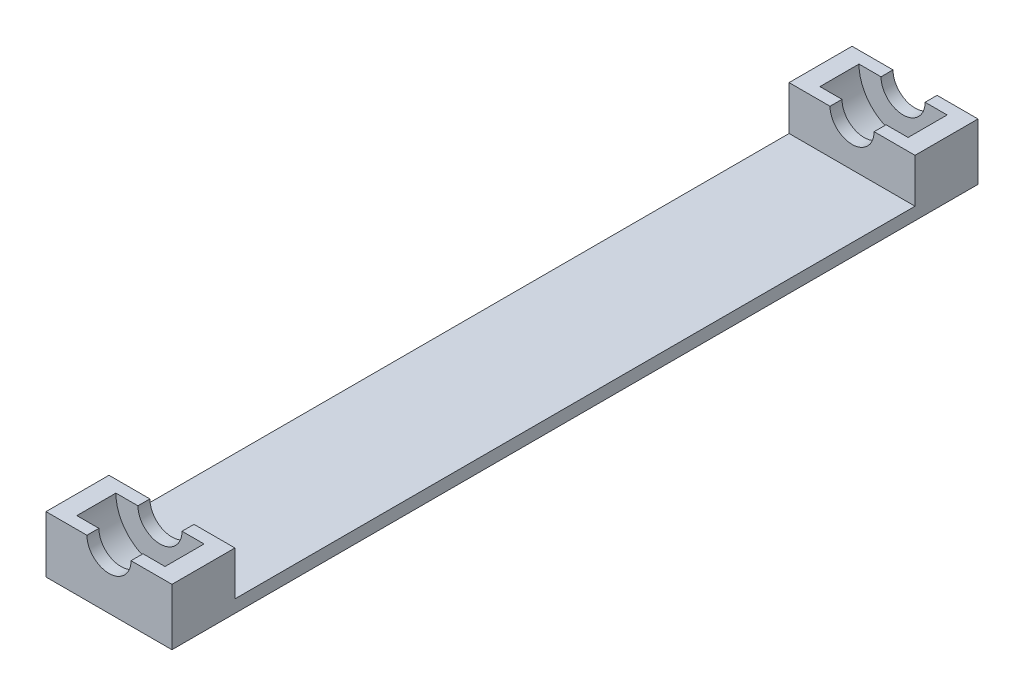
from build123d import *

# Parameters (mm, degrees)
BOSS_EXTRUDE1_DEPTH = 10
SKETCH2_R           = 3.5
SKETCH2_R_2         = 1.75
CUT_EXTRUDE1_DEPTH  = 1.55
SKETCH2_2_R         = 1.75
CUT_EXTRUDE2_DEPTH  = 6.6


with BuildPart() as part:
    # Sketch1 → Boss-Extrude1 (new body)
    with BuildSketch(Plane(origin=(0, 0, 0), x_dir=(0, 0, -1), z_dir=(1, 0, 0))):
        Polygon((-32, 4), (-32, -0.5), (32, -0.5), (32, 4), (27, 4), (27, 0.5), (-27, 0.5), (-27, 4), align=None)
    extrude(amount=BOSS_EXTRUDE1_DEPTH)

    # Sketch2 → Cut-Extrude1 (cut, symmetric)
    with BuildSketch(Plane.XY.offset(29.5)):
        with Locations((5, 4)):
            Circle(SKETCH2_R)
        with Locations((5, 4)):
            Circle(SKETCH2_R_2, mode=Mode.SUBTRACT)
    cut_extrude1 = extrude(amount=CUT_EXTRUDE1_DEPTH, both=True, mode=Mode.SUBTRACT)

    # Sketch2<2> → Cut-Extrude2 (cut, symmetric)
    with BuildSketch(Plane.XY.offset(29.5)):
        with Locations((5, 4)):
            Circle(SKETCH2_2_R)
    cut_extrude2 = extrude(amount=CUT_EXTRUDE2_DEPTH, both=True, mode=Mode.SUBTRACT)

    # Mirror1: Cut-Extrude1 across plane
    add(cut_extrude1.mirror(Plane.XY), mode=Mode.SUBTRACT)

    # Mirror2: Cut-Extrude2 across plane
    add(cut_extrude2.mirror(Plane.XY), mode=Mode.SUBTRACT)


solid = part.part
